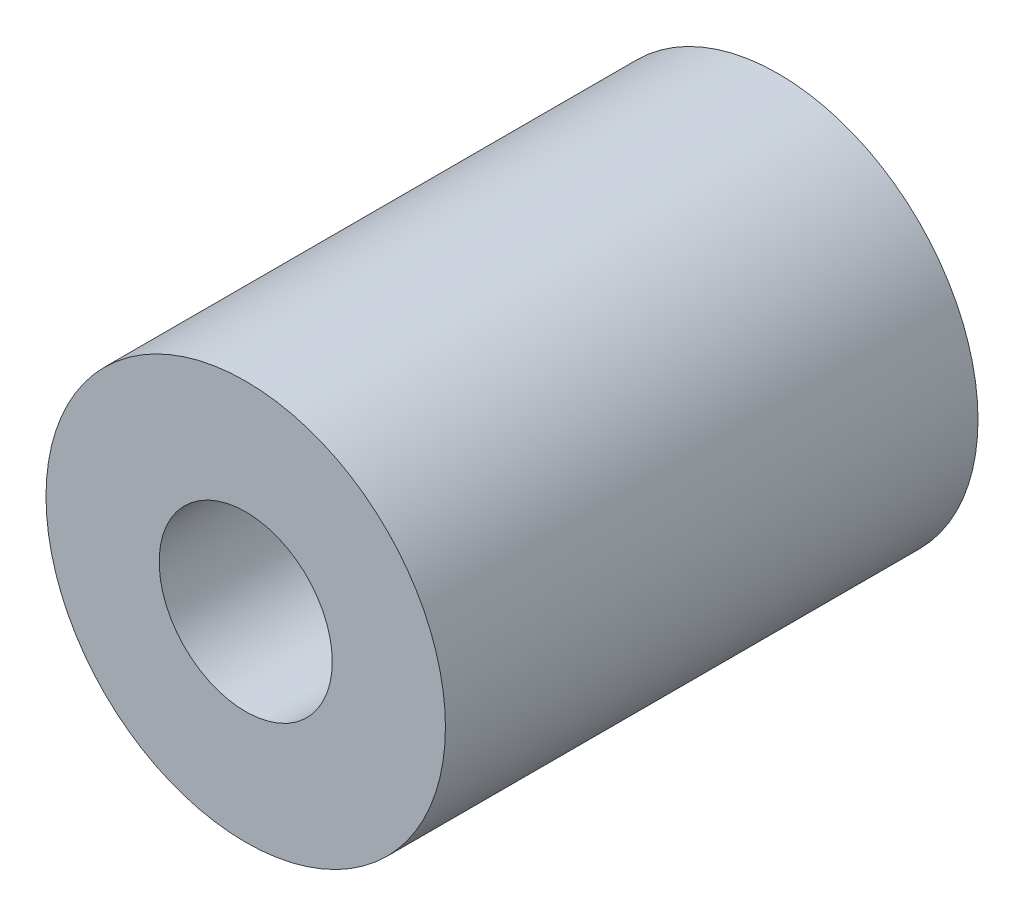
from build123d import *

# Parameters (mm, degrees)
SKETCH_1_R      = 3
SKETCH_1_R_2    = 1.3
EXTRUDE_1_DEPTH = 8


with BuildPart() as part:
    # ｽｹｯﾁ1 → ﾎﾞｽ - 押し出し1 (new body)
    with BuildSketch(Plane.XY):
        Circle(SKETCH_1_R)
        Circle(SKETCH_1_R_2, mode=Mode.SUBTRACT)
    extrude(amount=EXTRUDE_1_DEPTH)


solid = part.part
